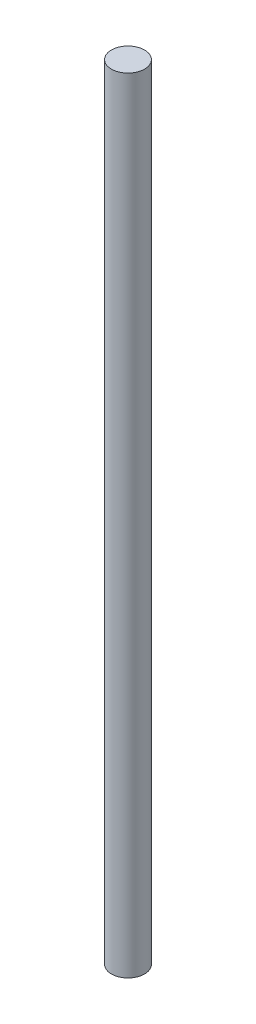
from build123d import *

# Parameters (mm, degrees)
ESBO_O1_R                = 3.175
RESSALTO_EXTRUS_O1_DEPTH = 150


with BuildPart() as part:
    # Esboço1 → Ressalto-extrusão1 (new body)
    with BuildSketch(Plane(origin=(0, 0, 0), x_dir=(1, 0, 0), z_dir=(0, 1, 0))):
        with Locations(Location((0, 0, 0), (0, 0, 270))):
            Circle(ESBO_O1_R)
    extrude(amount=RESSALTO_EXTRUS_O1_DEPTH)


solid = part.part
